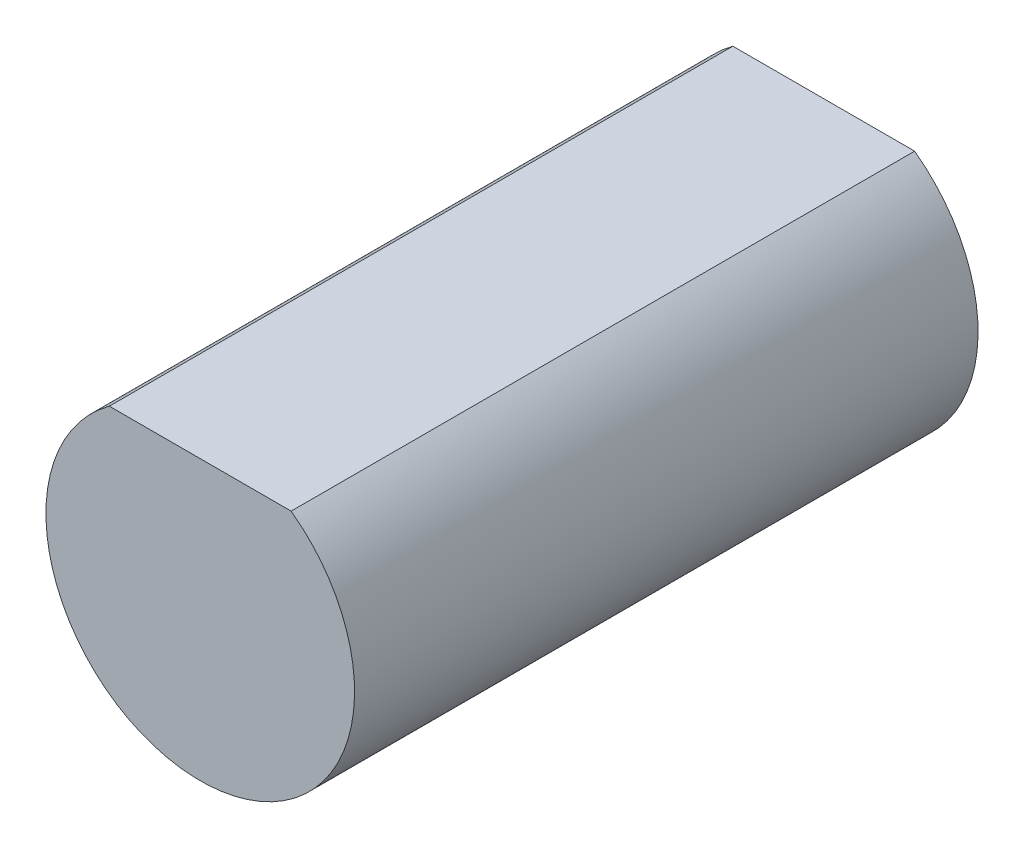
from build123d import *

# Parameters (mm, degrees)
SKETCH_1_R          = 9.9
EXTRUDE_1_DEPTH     = 40
CUT_EXTRUDE_1_DEPTH = 43.379476165


with BuildPart() as part:
    # 草图1 → 凸台-拉伸1 (new body)
    with BuildSketch(Plane.XY):
        Circle(SKETCH_1_R)
    extrude(amount=EXTRUDE_1_DEPTH)

    # 草图2 → 切除-拉伸1 (cut, through all)
    with BuildSketch(Plane.XY.offset(40)):
        with BuildLine():
            Line((-6, 8), (6, 8))
            ThreePointArc((6, 8), (0, 10), (-6, 8))
        make_face()
    extrude(amount=-CUT_EXTRUDE_1_DEPTH, mode=Mode.SUBTRACT)


solid = part.part
